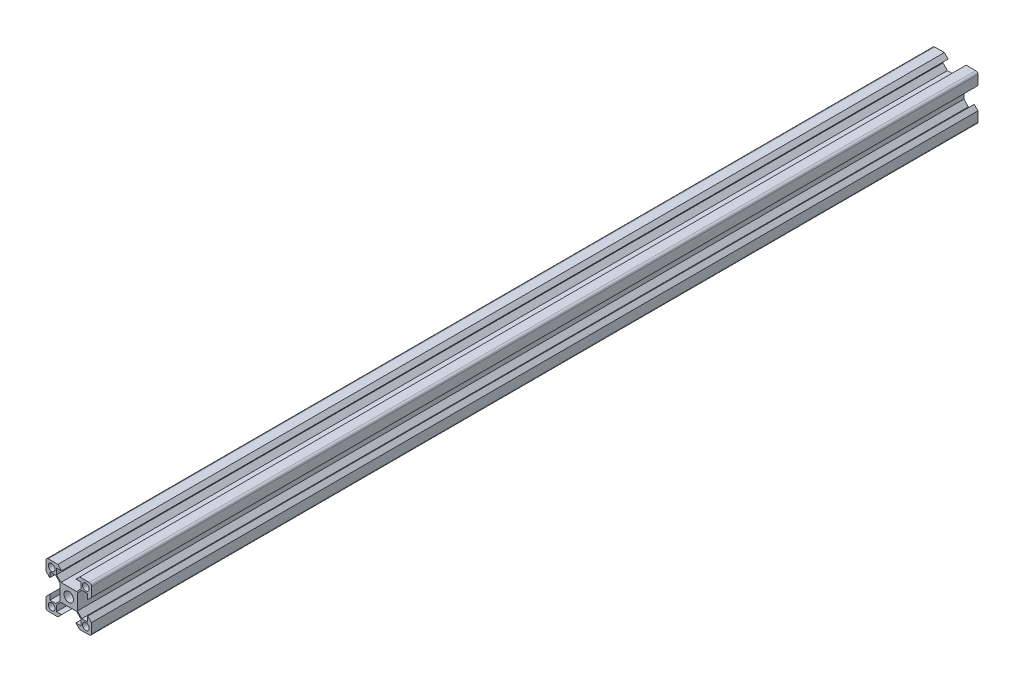
from build123d import *

# Parameters (mm, degrees)
SKETCH_1_R      = 1.5
SKETCH_1_R_2    = 2.1
EXTRUDE_1_DEPTH = 195
FILLET_1_R      = 1


with BuildPart() as part:
    # 草图1 → 凸台-拉伸1 (new, symmetric)
    with BuildSketch(Plane.XY):
        Polygon((-10, 10), (-10, 4.8), (-8.34, 3.14), (-8.34, 5.4), (-5.753553391, 5.4), (-3.8, 3.446446609), (-3.8, -3.446446609), (-5.753553391, -5.4), (-8.34, -5.4), (-8.34, -3.14), (-10, -4.8), (-10, -10), (-4.8, -10), (-3.14, -8.34), (-5.4, -8.34), (-5.4, -5.753553391), (-3.446446609, -3.8), (3.446446609, -3.8), (5.4, -5.753553391), (5.4, -8.34), (3.14, -8.34), (4.8, -10), (10, -10), (10, -4.8), (8.34, -3.14), (8.34, -5.4), (5.753553391, -5.4), (3.8, -3.446446609), (3.8, 3.446446609), (5.753553391, 5.4), (8.34, 5.4), (8.34, 3.14), (10, 4.8), (10, 10), (4.8, 10), (3.14, 8.34), (5.4, 8.34), (5.4, 5.753553391), (3.446446609, 3.8), (-3.446446609, 3.8), (-5.4, 5.753553391), (-5.4, 8.34), (-3.14, 8.34), (-4.8, 10), align=None)
        with Locations((-7.5, 7.5)):
            Circle(SKETCH_1_R, mode=Mode.SUBTRACT)
        Circle(SKETCH_1_R_2, mode=Mode.SUBTRACT)
        with Locations(Location((-7.5, -7.5, 0), (0, 0, 180))):
            Circle(SKETCH_1_R, mode=Mode.SUBTRACT)
        with Locations((7.5, -7.5)):
            Circle(SKETCH_1_R, mode=Mode.SUBTRACT)
        with Locations(Location((7.5, 7.5, 0), (0, 0, 180))):
            Circle(SKETCH_1_R, mode=Mode.SUBTRACT)
    extrude(amount=EXTRUDE_1_DEPTH, both=True)

    # 圆角1
    fillet_1_edges = [part.edges().sort_by_distance(p)[0] for p in [
        (10, 10, 0),
        (10, -10, 0),
        (-10, -10, 0),
        (-10, 10, 0),
    ]]
    fillet(fillet_1_edges, radius=FILLET_1_R)


solid = part.part
